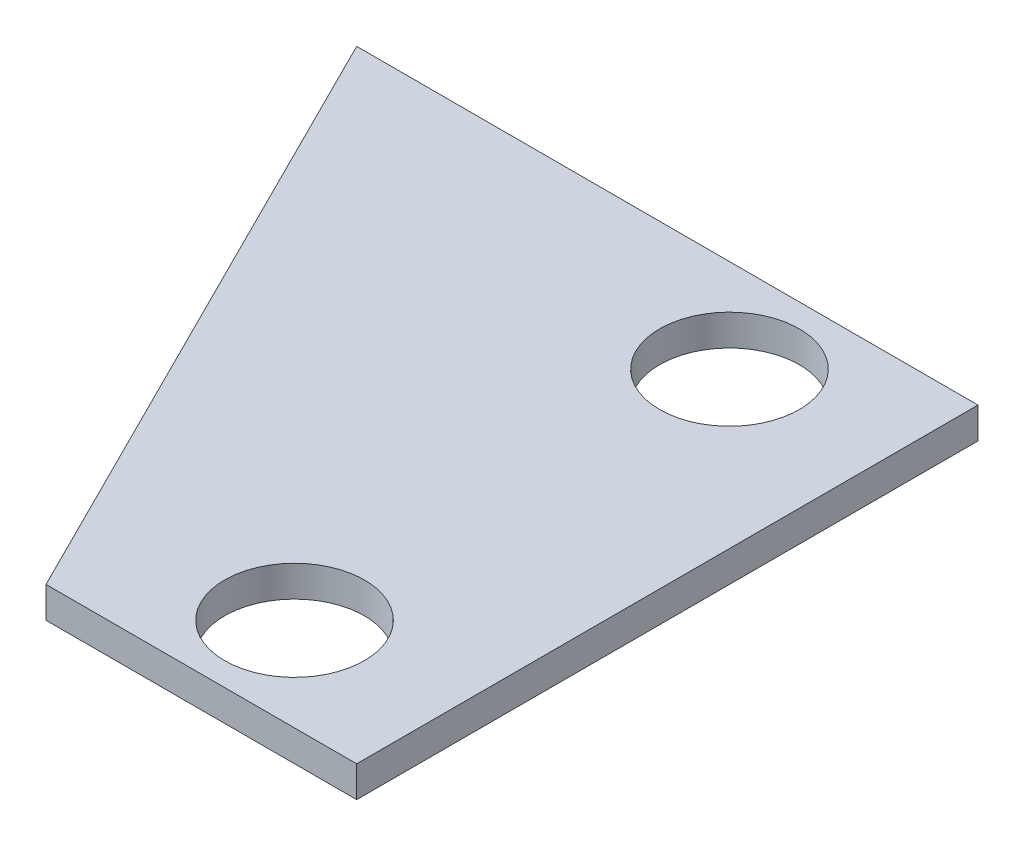
from build123d import *

# Parameters (mm, degrees)
SKETCH1_R           = 2.25
BOSS_EXTRUDE1_DEPTH = 1


with BuildPart() as part:
    # Sketch1 → Boss-Extrude1 (new body)
    with BuildSketch(Plane(origin=(0, 0, 0), x_dir=(1, 0, 0), z_dir=(0, 1, 0))):
        Polygon((-5, -10), (-15, 10), (-5, 10), (5, 10), (5, -10), align=None)
        with Locations(Location((0, 7, 0), (0, 0, 270))):
            Circle(SKETCH1_R, mode=Mode.SUBTRACT)
        with Locations(Location((0, -7, 0), (0, 0, 270))):
            Circle(SKETCH1_R, mode=Mode.SUBTRACT)
    extrude(amount=BOSS_EXTRUDE1_DEPTH)


solid = part.part
